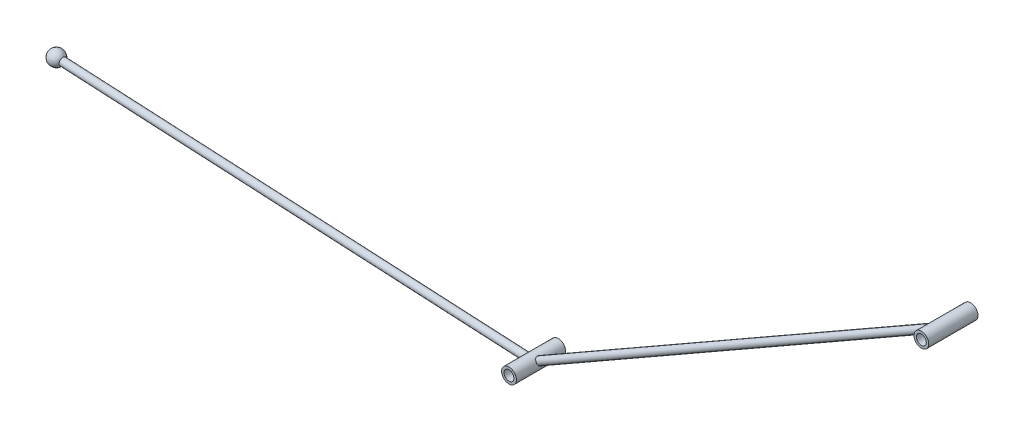
from build123d import *

# Parameters (mm, degrees)
ESQUISSE4_R             = 1.5
ESQUISSE6_R             = 3
BOSS_EXTRU_1_DEPTH      = 10
ESQUISSE7_R             = 2
ENL_V_MAT_EXTRU_1_DEPTH = 339.993691721


with BuildPart() as part:
    # Balayage1: sweep along a path in Esquisse3
    with BuildLine(Plane.XY) as balayage1_path:
        Line((-291.161591592, -154.331808471), (-97.417301145, -164.289213701))
        Line((-97.417301145, -164.289213701), (71, -68))
    # Esquisse4 → Balayage1 (sweep)
    with BuildSketch(Plane(origin=(-291.161591592, -154.331808471, 0), x_dir=(-0.05132683108289724, -0.9986819095242427, 0), z_dir=(0.9986819095242427, -0.05132683108289724, 0))):
        Circle(ESQUISSE4_R)
    sweep(path=balayage1_path.line, transition=Transition.RIGHT)

    # Esquisse5 → Révolution1 (revolve)
    with BuildSketch(Plane.XY):
        with BuildLine():
            Line((-288.165545864, -154.485788964), (-294.157637321, -154.177827978))
            ThreePointArc((-294.157637321, -154.177827978), (-291.007611099, -151.335762742), (-288.165545864, -154.485788964))
        make_face()
    revolve(axis=Axis((-288.165545864, -154.485788964, 0), (-0.9986819095242425, 0.05132683108290165, 0)))

    # Esquisse6 → Boss.-Extru.1 (add, symmetric)
    with BuildSketch(Plane.XY):
        with Locations((-97.417301145, -164.289213701)):
            Circle(ESQUISSE6_R)
        with Locations((70, -68)):
            Circle(ESQUISSE6_R)
    extrude(amount=BOSS_EXTRU_1_DEPTH, both=True)

    # Esquisse7 → Enlèv. mat.-Extru.1 (cut, through all)
    with BuildSketch(Plane.XY.offset(10)):
        with Locations((-97.417301145, -164.289213701)):
            Circle(ESQUISSE7_R)
        with Locations((70, -68)):
            Circle(ESQUISSE7_R)
    extrude(amount=-ENL_V_MAT_EXTRU_1_DEPTH, mode=Mode.SUBTRACT)


solid = part.part
